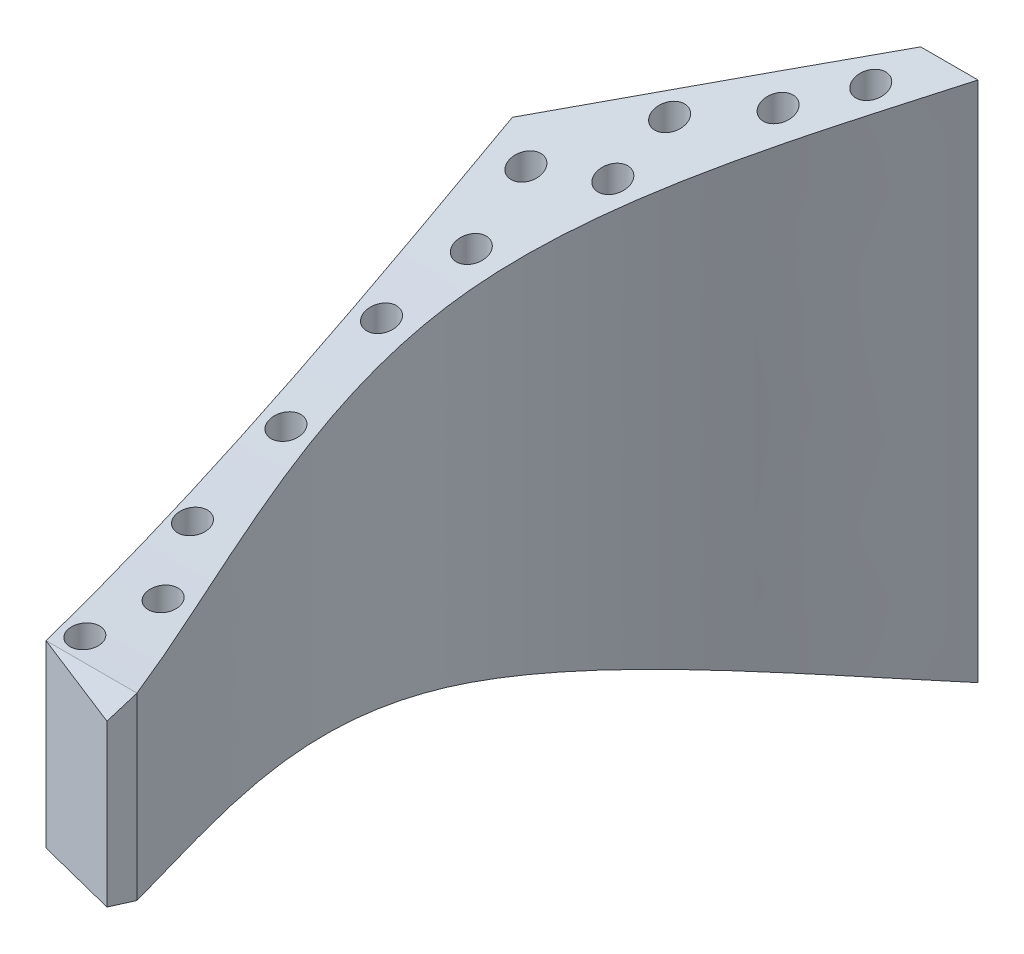
from build123d import *

# Parameters (mm, degrees)
EXTRUDE_1_DEPTH     = 52.687
CUT_EXTRUDE_1_DEPTH = 139.687
EXTRUDE_3_DEPTH     = 18.127
CUT_EXTRUDE_2_DEPTH = 23.687
F_1_0MM_1_D         = 3


with BuildPart() as part:
    # 草图1 → 凸台-拉伸1 (new body)
    with BuildSketch(Plane(origin=(0, 0, 0), x_dir=(1, 0, 0), z_dir=(0, 1, 0))):
        with BuildLine():
            Line((-11.380957104, 63.017430453), (-31.459230583, 41.878665905))
            Line((-31.459230583, 41.878665905), (-20.90659941, -15.749206581))
            Line((-20.90659941, -15.749206581), (-11.72369941, -15.749206581))
            add(Edge.make_bspline(
                [(-11.72369941, -15.749206581), (-16.269175643, -2.483619415), (-30.449052461, 26.424895809), (-12.159598213, 52.248826139), (-5.598733743, 63.017430453)],
                knots=[0, 0, 0, 0, 0.528075889, 1, 1, 1, 1], degree=3))
            Line((-5.598733743, 63.017430453), (-11.380957104, 63.017430453))
        make_face()
    extrude(amount=EXTRUDE_1_DEPTH)

    # 草图3 → 切除-拉伸1 (cut)
    with BuildSketch(Plane(origin=(-31.459230583, 0, 0), x_dir=(0, 0, -1), z_dir=(1, 0, 0))):
        with BuildLine():
            Line((-15.749206581, 52.687), (-15.749206581, 35.407))
            add(Edge.make_bspline(
                [(-15.749206581, 35.407), (11.139012207, 37.881118545), (37.020112351, 45.971092493), (63.017430453, 52.687)],
                knots=[0, 0, 0, 0, 1, 1, 1, 1], degree=3))
            Line((63.017430453, 52.687), (-15.749206581, 52.687))
        make_face()
        with BuildLine():
            add(Edge.make_bspline(
                [(-15.749206581, 17.28), (11.139012207, 14.805881455), (37.020112351, 6.715907507), (63.017430453, 0)],
                knots=[0, 0, 0, 0, 1, 1, 1, 1], degree=3))
            Line((63.017430453, 0), (-15.749206581, 0))
            Line((-15.749206581, 0), (-15.749206581, 17.28))
        make_face()
    extrude(amount=CUT_EXTRUDE_1_DEPTH, mode=Mode.SUBTRACT)

    # 草图7 → 凸台-拉伸3 (add)
    with BuildSketch(Plane(origin=(0, 35.407, 0), x_dir=(-1, 0, 0), z_dir=(0, 1, 0))):
        Polygon((11.72369941, 15.749206581), (11.72369941, 18.779006581), (20.90659941, 15.749206581), align=None)
    extrude(amount=-EXTRUDE_3_DEPTH)

    # 草图12 → 切除-拉伸2 (cut)
    with BuildSketch(Plane(origin=(-20.90659941, 0, 0), x_dir=(0, 0, -1), z_dir=(1, 0, 0))):
        Polygon((-30.779206581, 35.407), (-30.779206581, 30.767), (-15.749206581, 35.407), align=None)
        Polygon((-30.779206581, 21.92), (-15.749206581, 17.28), (-30.779206581, 17.28), align=None)
    extrude(amount=CUT_EXTRUDE_2_DEPTH, mode=Mode.SUBTRACT)

    # Ø1.0mm 暗销孔1 (through all)
    with Locations(Plane.XZ):
        with Locations((-11.788906059, -58.382424416), (-15.849722772, -53.088859772), (-21.868433259, -48.157868048), (-21.070772833, -41.631555473), (-27.234512487, -39.021030442), (-24.84153121, -31.116940768), (-25.421647883, -22.63273442), (-23.391239526, -10.957886368), (-21.868433259, 0), (-17.662587377, 7.170759675), (-19.11287906, 13.624557666)):
            Hole(F_1_0MM_1_D / 2)


solid = part.part
